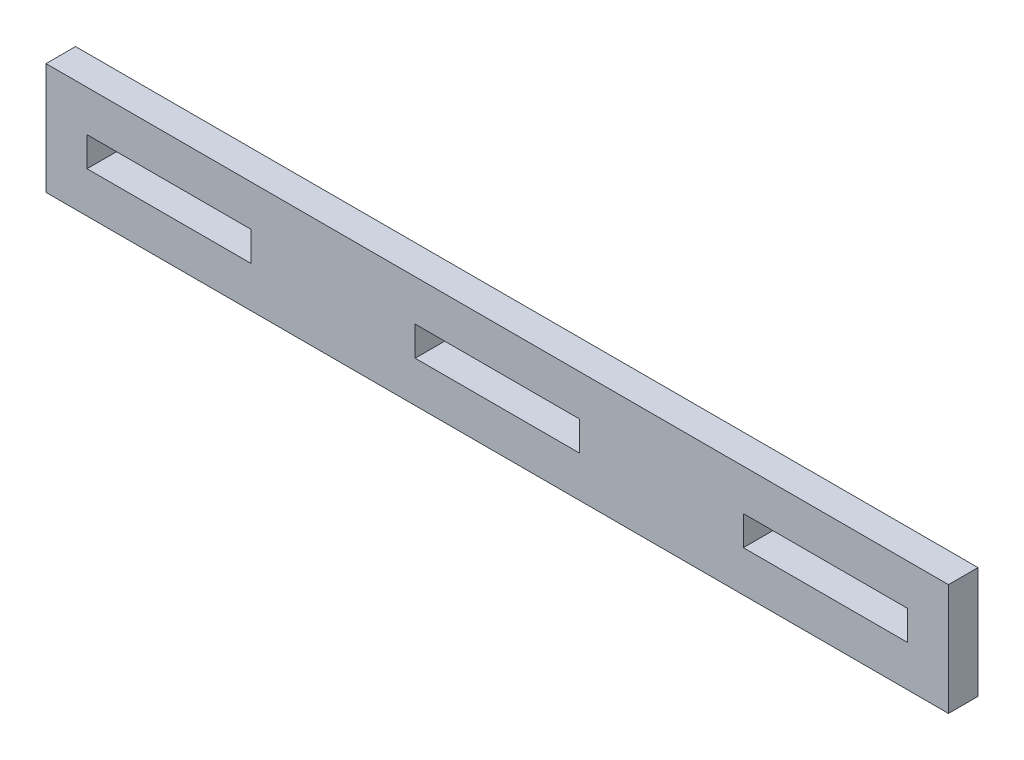
from build123d import *

# Parameters (mm, degrees)
SKETCH2_W           = 139.7
SKETCH2_H           = 17.272
BOSS_EXTRUDE1_DEPTH = 4.572
SKETCH3_W           = 25.4
SKETCH3_H           = 4.572
CUT_EXTRUDE1_DEPTH  = 4.572


with BuildPart() as part:
    # Sketch2 → Boss-Extrude1 (new body)
    with BuildSketch(Plane.XY):
        with Locations((69.85, 8.636)):
            Rectangle(SKETCH2_W, SKETCH2_H)
    extrude(amount=BOSS_EXTRUDE1_DEPTH)

    # Sketch3 → Cut-Extrude1 (cut)
    with BuildSketch(Plane.XY.offset(4.572)):
        with Locations((120.65, 8.636)):
            Rectangle(SKETCH3_W, SKETCH3_H)
        with Locations((69.85, 8.636)):
            Rectangle(SKETCH3_W, SKETCH3_H)
        with Locations((19.05, 8.636)):
            Rectangle(SKETCH3_W, SKETCH3_H)
    extrude(amount=-CUT_EXTRUDE1_DEPTH, mode=Mode.SUBTRACT)


solid = part.part
